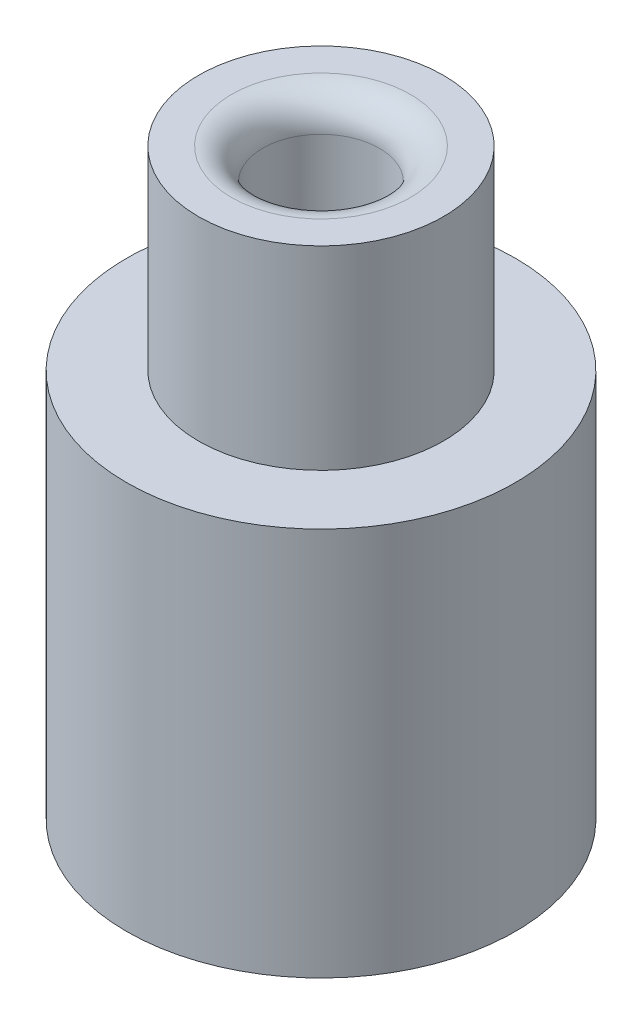
from build123d import *

# Parameters (mm, degrees)
BOSS_EXTRU_1_DEPTH      = 6
BOSS_EXTRU_1_DEPTH_BACK = 4
ESQUISSE1_R             = 5
BOSS_EXTRU_2_DEPTH      = 5
BOSS_EXTRU_2_DEPTH_BACK = 1
ESQUISSE2_R             = 3.15
ESQUISSE3_R             = 1.5
ENL_V_MAT_EXTRU_2_DEPTH = 10
ESQUISSE4_R             = 2.25
ENL_V_MAT_EXTRU_3_DEPTH = 5
CONG_1_R                = 0.8


with BuildPart() as part:
    # Esquisse1 → Boss.-Extru.1 (new, two sides: drawn at the far end of the back side and taken through both)
    with BuildSketch(Plane(origin=(0, 0, 0), x_dir=(1, 0, 0), z_dir=(0, 1, 0)).offset(-BOSS_EXTRU_1_DEPTH_BACK)):
        with Locations(Location((0, 0, 0), (0, 0, 270))):
            Circle(ESQUISSE1_R)
    extrude(amount=BOSS_EXTRU_1_DEPTH + BOSS_EXTRU_1_DEPTH_BACK)

    # Esquisse2 → Boss.-Extru.2 (add, two sides: drawn at the far end of the back side and taken through both)
    with BuildSketch(Plane(origin=(0, 6, 0), x_dir=(1, 0, 0), z_dir=(0, 1, 0)).offset(-BOSS_EXTRU_2_DEPTH_BACK)):
        with Locations(Location((0, 0, 0), (0, 0, 270))):
            Circle(ESQUISSE2_R)
    extrude(amount=BOSS_EXTRU_2_DEPTH + BOSS_EXTRU_2_DEPTH_BACK)

    # Esquisse3 → Enlèv. mat.-Extru.2 (cut)
    with BuildSketch(Plane(origin=(0, 11, 0), x_dir=(1, 0, 0), z_dir=(0, 1, 0))):
        with Locations(Location((0, 0, 0), (0, 0, 270))):
            Circle(ESQUISSE3_R)
    extrude(amount=-ENL_V_MAT_EXTRU_2_DEPTH, mode=Mode.SUBTRACT)

    # Esquisse4 → Enlèv. mat.-Extru.3 (cut)
    with BuildSketch(Plane.XZ.offset(4)):
        with Locations(Location((0, 0, 0), (0, 0, 270))):
            Circle(ESQUISSE4_R)
    extrude(amount=-ENL_V_MAT_EXTRU_3_DEPTH, mode=Mode.SUBTRACT)

    # Congé1
    cong_1_edges = [part.edges().sort_by_distance(p)[0] for p in [
        (0, 11, -1.5),
    ]]
    fillet(cong_1_edges, radius=CONG_1_R)


solid = part.part
